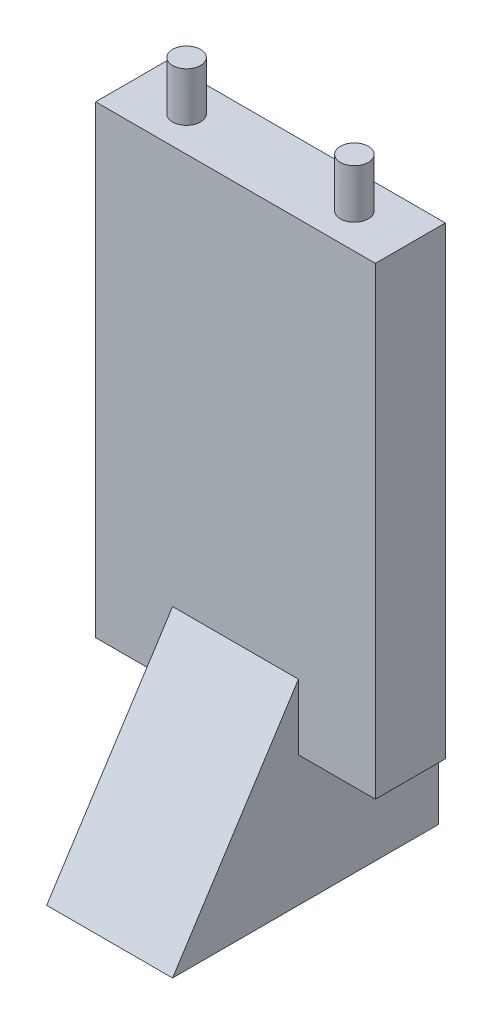
from build123d import *

# Parameters (mm, degrees)
SKETCH1_W           = 101.6
SKETCH1_H           = 25.4
BOSS_EXTRUDE1_DEPTH = 215.9
SKETCH2_R           = 5.08
BOSS_EXTRUDE2_DEPTH = 17.78
SKETCH3_W           = 27.94
SKETCH3_H           = 47.346080225
CUT_EXTRUDE1_DEPTH  = 27.686
SKETCH9_W           = 45.72
SKETCH9_H           = 71.12
BOSS_EXTRUDE5_DEPTH = 45.72
CUT_EXTRUDE4_DEPTH  = 45.72
BOSS_EXTRUDE6_DEPTH = 25.4


with BuildPart() as part:
    # Sketch1 → Boss-Extrude1 (new body)
    with BuildSketch(Plane(origin=(0, 0, 0), x_dir=(1, 0, 0), z_dir=(0, 1, 0))):
        with Locations((29.457987906, 2.028993953)):
            Rectangle(SKETCH1_W, SKETCH1_H)
    extrude(amount=BOSS_EXTRUDE1_DEPTH)

    # Sketch2 → Boss-Extrude2 (add)
    with BuildSketch(Plane(origin=(0, 215.9, 0), x_dir=(1, 0, 0), z_dir=(0, 1, 0))):
        with Locations(Location((-1.022012094, 2.028993953, 0), (0, 0, 90))):
            Circle(SKETCH2_R)
        with Locations(Location((59.937987906, 2.028993953, 0), (0, 0, 90))):
            Circle(SKETCH2_R)
    extrude(amount=BOSS_EXTRUDE2_DEPTH)

    # Sketch3 → Cut-Extrude1 (cut)
    with BuildSketch(Plane.XY.offset(10.671006047)):
        with Locations((-7.372012094, 23.673040113)):
            Rectangle(SKETCH3_W, SKETCH3_H)
        with Locations((66.287987906, 23.673040113)):
            Rectangle(SKETCH3_W, SKETCH3_H)
    extrude(amount=-CUT_EXTRUDE1_DEPTH, mode=Mode.SUBTRACT)

    # Sketch9 → Boss-Extrude5 (add)
    with BuildSketch(Plane.XY.offset(10.671006047)):
        with Locations((29.457987906, 35.56)):
            Rectangle(SKETCH9_W, SKETCH9_H)
    extrude(amount=BOSS_EXTRUDE5_DEPTH)

    # Sketch10 → Cut-Extrude4 (cut)
    with BuildSketch(Plane(origin=(52.317987906, 0, 0), x_dir=(0, 0, -1), z_dir=(1, 0, 0))):
        Polygon((-56.391006047, 71.12), (-10.671006047, 71.12), (-56.391006047, 0), align=None)
    extrude(amount=-CUT_EXTRUDE4_DEPTH, mode=Mode.SUBTRACT)

    # Sketch11 → Boss-Extrude6 (add)
    with BuildSketch(Plane(origin=(0, 0, -14.728993953), x_dir=(-1, 0, 0), z_dir=(0, 0, -1))):
        Polygon((-52.317987906, 47.346080225), (-52.317987906, 70.979374422), (-6.597987906, 70.979374422), (-6.597987906, 47.346080225), (-6.597987906, 0), (-52.317987906, 0), align=None)
    extrude(amount=BOSS_EXTRUDE6_DEPTH)


solid = part.part
